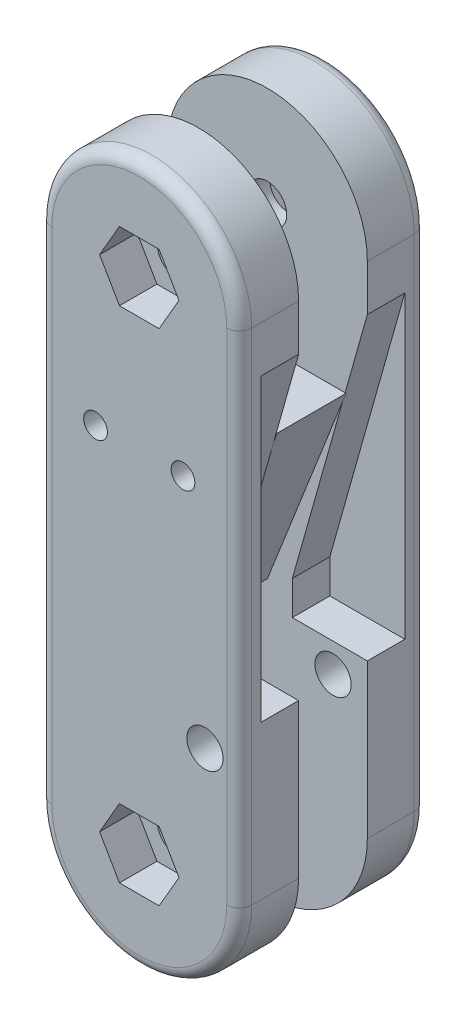
from build123d import *

# Parameters (mm, degrees)
SKETCH1_R           = 1.55
SKETCH1_R_2         = 1.45
BOSS_EXTRUDE1_DEPTH = 4.75
FILLET2_R           = 1
CUT_EXTRUDE1_DEPTH  = 3
BOSS_EXTRUDE2_DEPTH = 2.75
CUT_EXTRUDE2_DEPTH  = 3
SKETCH7_R           = 0.95
CUT_EXTRUDE3_DEPTH  = 51.921508226


with BuildPart() as part:
    # Sketch1 → Boss-Extrude1 (new body)
    with BuildSketch(Plane.XY):
        with BuildLine():
            Line((-8, 0), (-8, 40))
            ThreePointArc((-8, 40), (0, 48), (8, 40))
            Line((8, 40), (8, 0))
            ThreePointArc((8, 0), (0, -8), (-8, 0))
        make_face()
        with Locations((0, 40)):
            Circle(SKETCH1_R, mode=Mode.SUBTRACT)
        Circle(SKETCH1_R, mode=Mode.SUBTRACT)
        with Locations((5.258025032, 10)):
            Circle(SKETCH1_R_2, mode=Mode.SUBTRACT)
    extrude(amount=BOSS_EXTRUDE1_DEPTH)

    # Fillet2
    fillet2_edges = [part.edges().sort_by_distance(p)[0] for p in [
        (0, 48, 4.75),
        (-8, 20, 4.75),
        (0, -8, 4.75),
        (8, 20, 4.75),
    ]]
    fillet(fillet2_edges, radius=FILLET2_R)

    # Sketch2 → Cut-Extrude1 (cut)
    with BuildSketch(Plane.XY.offset(4.75)):
        Polygon((3.175426481, 40), (1.58771324, 42.75), (-1.58771324, 42.75), (-3.175426481, 40), (-1.58771324, 37.25), (1.58771324, 37.25), align=None)
        Polygon((3.175426481, 0), (1.58771324, 2.75), (-1.58771324, 2.75), (-3.175426481, 0), (-1.58771324, -2.75), (1.58771324, -2.75), align=None)
    extrude(amount=-CUT_EXTRUDE1_DEPTH, mode=Mode.SUBTRACT)

    # Sketch3 → Boss-Extrude2 (add)
    with BuildSketch(Plane(origin=(0, 0, 0), x_dir=(-1, 0, 0), z_dir=(0, 0, -1))):
        Polygon((8, 30), (3, 30), (-6.304970195, 30), (0, 14), (3, 12), (8, 12), align=None)
    extrude(amount=BOSS_EXTRUDE2_DEPTH)

    # Mirror5: part across plane


with BuildPart() as part_1:
    add(part.part)
    add(part.part.mirror(Plane.XY.offset(-2.75)))

    # Sketch4 → Cut-Extrude2 (cut)
    with BuildSketch(Plane.XY.offset(-5.5)):
        Polygon((2, 12.305922059), (2, 15.02352233), (8, 36.305922059), (8, 12.305922059), align=None)
    cut_extrude2 = extrude(amount=-CUT_EXTRUDE2_DEPTH, mode=Mode.SUBTRACT)

    # Mirror6: Cut-Extrude2 across plane
    add(cut_extrude2.mirror(Plane(origin=(0, 0, -2.75), x_dir=(1, 0, 0), z_dir=(0, 0, -1))), mode=Mode.SUBTRACT)

    # Sketch7 → Cut-Extrude3 (cut, through all)
    with BuildSketch(Plane(origin=(0, 0, -10.25), x_dir=(-1, 0, 0), z_dir=(0, 0, -1))):
        with Locations((-3.5, 28)):
            Circle(SKETCH7_R)
        with Locations(Location((3.5, 28, 0), (0, 0, 180))):
            Circle(SKETCH7_R)
    extrude(amount=-CUT_EXTRUDE3_DEPTH, mode=Mode.SUBTRACT)


solid = part_1.part
